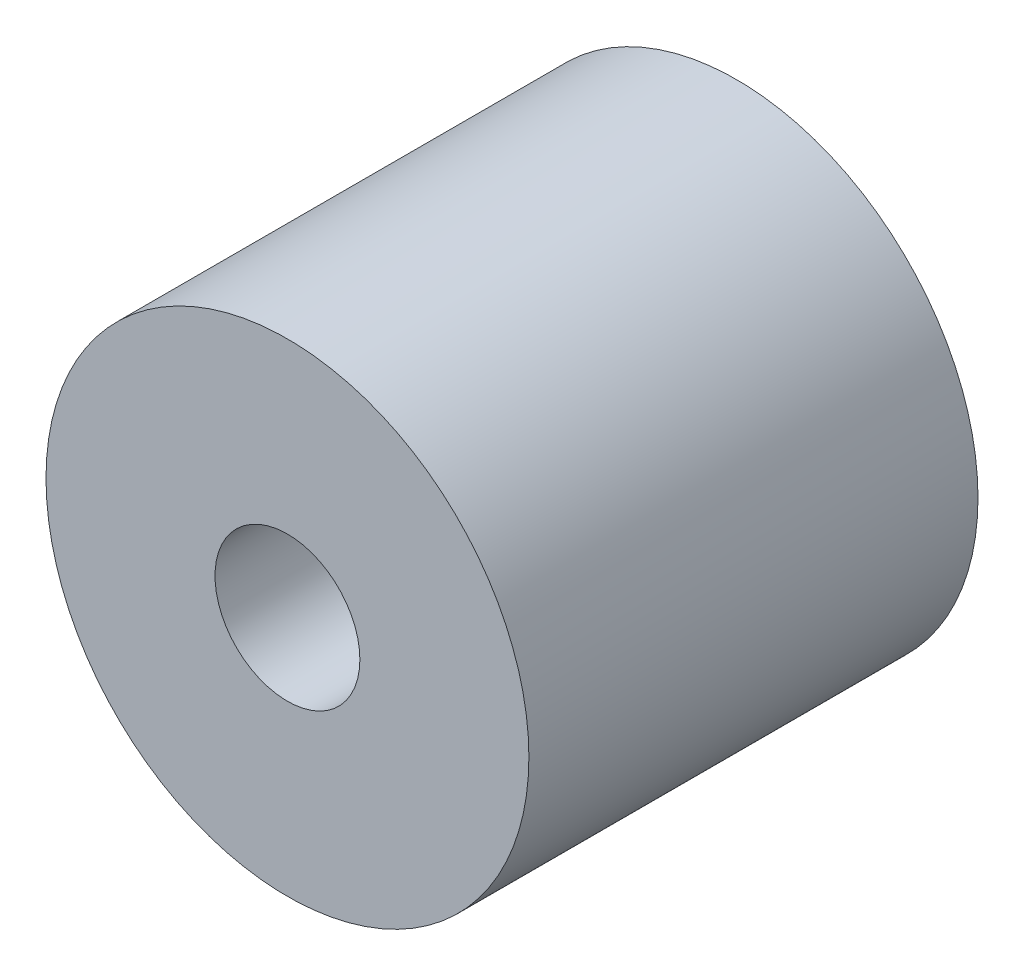
from build123d import *

# Parameters (mm, degrees)
SKIZZE1_R                            = 5
AUFSATZ_LINEAR_AUSTRAGEN1_DEPTH      = 9.3
SCHNITT_LINEAR_AUSTRAGEN1_DEPTH      = 12.682893477
SCHNITT_LINEAR_AUSTRAGEN1_DEPTH_BACK = 12.682893477
SKIZZE2_R                            = 1.5
SCHNITT_LINEAR_START                 = -10
SKIZZE9_R                            = 0.5
SCHNITT_LINEAR_AUSTRAGEN2_DEPTH      = 10


with BuildPart() as part:
    # Skizze1 → Aufsatz-Linear austragen1 (new body)
    with BuildSketch(Plane.XY):
        Circle(SKIZZE1_R)
    extrude(amount=AUFSATZ_LINEAR_AUSTRAGEN1_DEPTH)

    # Skizze2 → Schnitt-Linear austragen1 (cut, two sides: drawn at the far end of the back side and taken through both)
    with BuildSketch(Plane.XY.offset(9.3).offset(-SCHNITT_LINEAR_AUSTRAGEN1_DEPTH_BACK)):
        Circle(SKIZZE2_R)
    extrude(amount=SCHNITT_LINEAR_AUSTRAGEN1_DEPTH + SCHNITT_LINEAR_AUSTRAGEN1_DEPTH_BACK, mode=Mode.SUBTRACT)

    # Skizze8 → Ø1.0 (1) Durchmesser Bohrung3 (revolve, cut)
    with BuildSketch(Plane(origin=(0, 0, 2), x_dir=(0, 0, -1), z_dir=(1, 0, 0))):
        Polygon((0, 0), (0, 4.30043031), (0.5, 4), (0.5, 0), align=None)
    revolve(axis=Axis((0, -6.35, 2), (0, 1, 0)), mode=Mode.SUBTRACT)

    # Skizze9 → Schnitt-Linear austragen2 (cut)
    with BuildSketch(Plane(origin=(0, 0, 0), x_dir=(1, 0, 0), z_dir=(0, 1, 0)).offset(SCHNITT_LINEAR_START)):
        with Locations(Location((0, -2, 0), (0, 0, 90))):
            Circle(SKIZZE9_R)
    extrude(amount=SCHNITT_LINEAR_AUSTRAGEN2_DEPTH, mode=Mode.SUBTRACT)


solid = part.part
